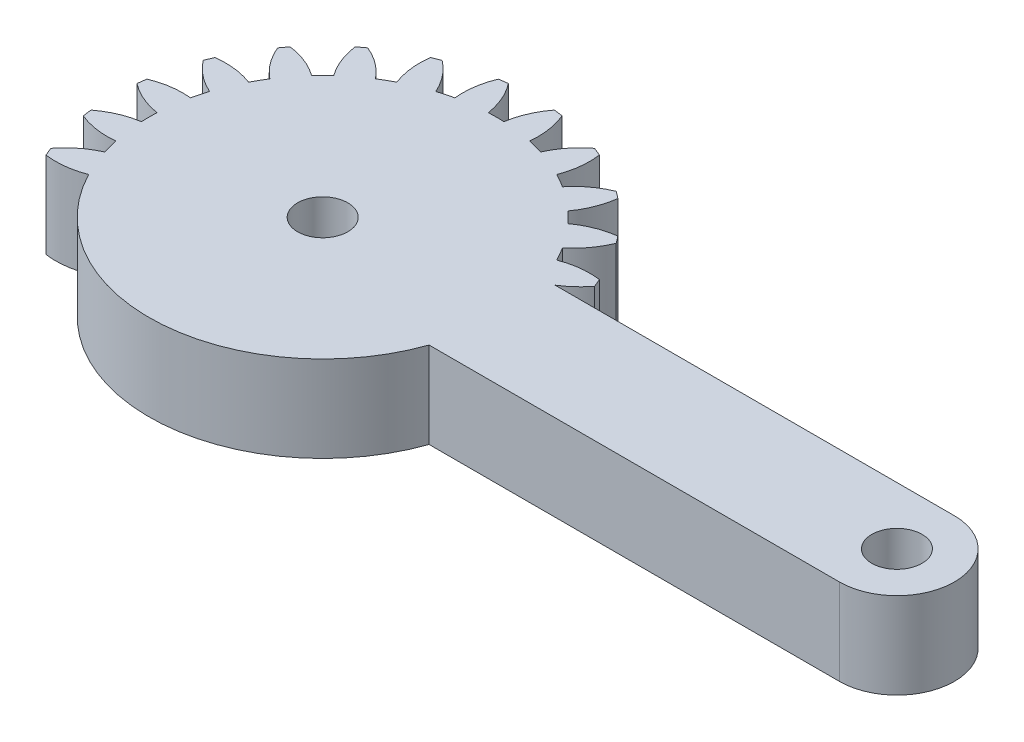
from build123d import *
from build123d.topology import SkipClean

# Parameters (mm, degrees)
SKETCH1_R           = 1.75
BOSS_EXTRUDE1_DEPTH = 4
CUT_EXTRUDE1_START  = -10
CUT_EXTRUDE1_DEPTH  = 10
MOVE_FACE1_BY       = 2


with BuildPart() as part:
    # Sketch1 → Boss-Extrude1 (new body)
    with BuildSketch(Plane(origin=(0, 0, 0), x_dir=(1, 0, 0), z_dir=(0, 1, 0))):
        with BuildLine():
            Line((29.893657446, 4), (2.081641936, 4))
            ThreePointArc((2.081641936, 4), (2.861028333, 4.588201733), (3.521749436, 5.30713988))
            ThreePointArc((3.521749436, 5.30713988), (3.405395609, 5.596745198), (3.282888305, 5.883801663))
            ThreePointArc((3.282888305, 5.883801663), (1.93527598, 5.894040025), (0.627094961, 5.57027124))
            ThreePointArc((0.627094961, 5.57027124), (0.366286148, 6.046375), (0.084372603, 6.510293938))
            ThreePointArc((0.084372603, 6.510293938), (1.018855105, 7.48132754), (1.683794586, 8.65351323))
            ThreePointArc((1.683794586, 8.65351323), (1.496450048, 8.903135899), (1.303821399, 9.148703928))
            ThreePointArc((1.303821399, 9.148703928), (-0.000522033, 8.809805691), (-1.180330337, 8.158486898))
            ThreePointArc((-1.180330337, 8.158486898), (-1.555477026, 8.550865528), (-1.947855656, 8.926012217))
            ThreePointArc((-1.947855656, 8.926012217), (-1.296536862, 10.105820521), (-0.957638625, 11.410163953))
            ThreePointArc((-0.957638625, 11.410163953), (-1.203206655, 11.602792602), (-1.452829324, 11.79013714))
            ThreePointArc((-1.452829324, 11.79013714), (-2.625015014, 11.125197659), (-3.596048616, 10.190715157))
            ThreePointArc((-3.596048616, 10.190715157), (-4.059967554, 10.472628702), (-4.536071314, 10.733437515))
            ThreePointArc((-4.536071314, 10.733437515), (-4.212302529, 12.041618533), (-4.222540891, 13.389230859))
            ThreePointArc((-4.222540891, 13.389230859), (-4.509597355, 13.511738163), (-4.799202674, 13.62809199))
            ThreePointArc((-4.799202674, 13.62809199), (-5.759348103, 12.682425791), (-6.455432668, 11.528463019))
            ThreePointArc((-6.455432668, 11.528463019), (-6.976508546, 11.680699536), (-7.503891752, 11.809396783))
            ThreePointArc((-7.503891752, 11.809396783), (-7.529737283, 13.156800143), (-7.888414517, 14.455843809))
            ThreePointArc((-7.888414517, 14.455843809), (-8.197396993, 14.499881098), (-8.507248835, 14.537314892))
            ThreePointArc((-8.507248835, 14.537314892), (-9.18992168, 13.375367565), (-9.563620196, 12.080565177))
            ThreePointArc((-9.563620196, 12.080565177), (-10.106342554, 12.09275), (-10.649064912, 12.080565177))
            ThreePointArc((-10.649064912, 12.080565177), (-11.022763428, 13.375367565), (-11.705436272, 14.537314892))
            ThreePointArc((-11.705436272, 14.537314892), (-12.015288115, 14.499881098), (-12.324270591, 14.455843809))
            ThreePointArc((-12.324270591, 14.455843809), (-12.682947825, 13.156800143), (-12.708793355, 11.809396783))
            ThreePointArc((-12.708793355, 11.809396783), (-13.236176561, 11.680699536), (-13.757252439, 11.528463019))
            ThreePointArc((-13.757252439, 11.528463019), (-14.453337005, 12.682425791), (-15.413482434, 13.62809199))
            ThreePointArc((-15.413482434, 13.62809199), (-15.703087752, 13.511738163), (-15.990144217, 13.389230859))
            ThreePointArc((-15.990144217, 13.389230859), (-16.000382579, 12.041618533), (-15.676613793, 10.733437515))
            ThreePointArc((-15.676613793, 10.733437515), (-16.152717554, 10.472628702), (-16.616636492, 10.190715157))
            ThreePointArc((-16.616636492, 10.190715157), (-17.587670094, 11.125197659), (-18.759855783, 11.79013714))
            ThreePointArc((-18.759855783, 11.79013714), (-19.009478453, 11.602792602), (-19.255046482, 11.410163953))
            ThreePointArc((-19.255046482, 11.410163953), (-18.916148245, 10.105820521), (-18.264829452, 8.926012217))
            ThreePointArc((-18.264829452, 8.926012217), (-18.657208082, 8.550865528), (-19.032354771, 8.158486898))
            ThreePointArc((-19.032354771, 8.158486898), (-20.212163074, 8.809805691), (-21.516506507, 9.148703928))
            ThreePointArc((-21.516506507, 9.148703928), (-21.709135156, 8.903135899), (-21.896479694, 8.65351323))
            ThreePointArc((-21.896479694, 8.65351323), (-21.231540213, 7.48132754), (-20.297057711, 6.510293938))
            ThreePointArc((-20.297057711, 6.510293938), (-20.578971255, 6.046375), (-20.839780068, 5.57027124))
            ThreePointArc((-20.839780068, 5.57027124), (-22.147961087, 5.894040025), (-23.495573413, 5.883801663))
            ThreePointArc((-23.495573413, 5.883801663), (-23.618080717, 5.596745198), (-23.734434544, 5.30713988))
            ThreePointArc((-23.734434544, 5.30713988), (-22.788768345, 4.346994451), (-21.634805572, 3.650909885))
            ThreePointArc((-21.634805572, 3.650909885), (-21.78704209, 3.129834008), (-21.915739337, 2.602450802))
            ThreePointArc((-21.915739337, 2.602450802), (-23.263142697, 2.576605271), (-24.562186363, 2.217928037))
            ThreePointArc((-24.562186363, 2.217928037), (-24.606223651, 1.908945561), (-24.643657446, 1.599093719))
            ThreePointArc((-24.643657446, 1.599093719), (-23.481710119, 0.916420874), (-22.186907731, 0.542722358))
            ThreePointArc((-22.186907731, 0.542722358), (-22.199092554, 0), (-22.186907731, -0.542722358))
            ThreePointArc((-22.186907731, -0.542722358), (-23.481710119, -0.916420874), (-24.643657446, -1.599093719))
            ThreePointArc((-24.643657446, -1.599093719), (-24.606223651, -1.908945561), (-24.562186363, -2.217928037))
            ThreePointArc((-24.562186363, -2.217928037), (-23.263142697, -2.576605271), (-21.915739337, -2.602450802))
            ThreePointArc((-21.915739337, -2.602450802), (-21.78704209, -3.129834008), (-21.634805572, -3.650909885))
            ThreePointArc((-21.634805572, -3.650909885), (-22.788768345, -4.346994451), (-23.734434544, -5.30713988))
            ThreePointArc((-23.734434544, -5.30713988), (-23.618080717, -5.596745198), (-23.495573413, -5.883801663))
            ThreePointArc((-23.495573413, -5.883801663), (-22.147961087, -5.894040025), (-20.839780068, -5.57027124))
            ThreePointArc((-20.839780068, -5.57027124), (-20.578971255, -6.046375), (-20.297057711, -6.510293938))
            ThreePointArc((-20.297057711, -6.510293938), (-21.231540213, -7.48132754), (-21.896479694, -8.65351323))
            ThreePointArc((-21.896479694, -8.65351323), (-21.709135156, -8.903135899), (-21.516506507, -9.148703928))
            ThreePointArc((-21.516506507, -9.148703928), (-20.212163074, -8.809805691), (-19.032354771, -8.158486898))
            ThreePointArc((-19.032354771, -8.158486898), (-18.657208082, -8.550865528), (-18.264829452, -8.926012217))
            ThreePointArc((-18.264829452, -8.926012217), (-18.916148245, -10.105820521), (-19.255046482, -11.410163953))
            ThreePointArc((-19.255046482, -11.410163953), (-19.009478453, -11.602792602), (-18.759855783, -11.79013714))
            ThreePointArc((-18.759855783, -11.79013714), (-17.587670094, -11.125197659), (-16.616636492, -10.190715157))
            ThreePointArc((-16.616636492, -10.190715157), (-16.152717554, -10.472628702), (-15.676613793, -10.733437515))
            ThreePointArc((-15.676613793, -10.733437515), (-16.000382579, -12.041618533), (-15.990144217, -13.389230859))
            ThreePointArc((-15.990144217, -13.389230859), (-15.703087752, -13.511738163), (-15.413482434, -13.62809199))
            ThreePointArc((-15.413482434, -13.62809199), (-14.453337005, -12.682425791), (-13.757252439, -11.528463019))
            ThreePointArc((-13.757252439, -11.528463019), (-13.236176561, -11.680699536), (-12.708793355, -11.809396783))
            ThreePointArc((-12.708793355, -11.809396783), (-12.682947825, -13.156800143), (-12.324270591, -14.455843809))
            ThreePointArc((-12.324270591, -14.455843809), (-12.015288115, -14.499881098), (-11.705436272, -14.537314892))
            ThreePointArc((-11.705436272, -14.537314892), (-11.022763428, -13.375367565), (-10.649064912, -12.080565177))
            ThreePointArc((-10.649064912, -12.080565177), (-10.106342554, -12.09275), (-9.563620196, -12.080565177))
            ThreePointArc((-9.563620196, -12.080565177), (-9.18992168, -13.375367565), (-8.507248835, -14.537314892))
            ThreePointArc((-8.507248835, -14.537314892), (-8.197396993, -14.499881098), (-7.888414517, -14.455843809))
            ThreePointArc((-7.888414517, -14.455843809), (-7.529737283, -13.156800143), (-7.503891752, -11.809396783))
            ThreePointArc((-7.503891752, -11.809396783), (-6.976508546, -11.680699536), (-6.455432668, -11.528463019))
            ThreePointArc((-6.455432668, -11.528463019), (-5.759348103, -12.682425791), (-4.799202674, -13.62809199))
            ThreePointArc((-4.799202674, -13.62809199), (-4.509597355, -13.511738163), (-4.222540891, -13.389230859))
            ThreePointArc((-4.222540891, -13.389230859), (-4.212302529, -12.041618533), (-4.536071314, -10.733437515))
            ThreePointArc((-4.536071314, -10.733437515), (-4.059967554, -10.472628702), (-3.596048616, -10.190715157))
            ThreePointArc((-3.596048616, -10.190715157), (-2.625015014, -11.125197659), (-1.452829324, -11.79013714))
            ThreePointArc((-1.452829324, -11.79013714), (-1.203206655, -11.602792602), (-0.957638625, -11.410163953))
            ThreePointArc((-0.957638625, -11.410163953), (-1.296536862, -10.105820521), (-1.947855656, -8.926012217))
            ThreePointArc((-1.947855656, -8.926012217), (-1.555477026, -8.550865528), (-1.180330337, -8.158486898))
            ThreePointArc((-1.180330337, -8.158486898), (-0.000522033, -8.809805691), (1.303821399, -9.148703928))
            ThreePointArc((1.303821399, -9.148703928), (1.496450048, -8.903135899), (1.683794586, -8.65351323))
            ThreePointArc((1.683794586, -8.65351323), (1.018855105, -7.48132754), (0.084372603, -6.510293938))
            ThreePointArc((0.084372603, -6.510293938), (0.366286148, -6.046375), (0.627094961, -5.57027124))
            ThreePointArc((0.627094961, -5.57027124), (1.93527598, -5.894040025), (3.282888305, -5.883801663))
            ThreePointArc((3.282888305, -5.883801663), (3.405395609, -5.596745198), (3.521749436, -5.30713988))
            ThreePointArc((3.521749436, -5.30713988), (2.861028333, -4.588201733), (2.081641936, -4))
            Line((2.081641936, -4), (29.893658255, -4))
            ThreePointArc((29.893658255, -4), (33.893657446, 4.04e-07), (29.893657446, 4))
        make_face()
        with Locations(Location((-10.106342554, 0, 0), (0, 0, 270))):
            Circle(SKETCH1_R, mode=Mode.SUBTRACT)
        with Locations(Location((29.893657446, 0, 0), (0, 0, 270))):
            Circle(SKETCH1_R, mode=Mode.SUBTRACT)
    extrude(amount=BOSS_EXTRUDE1_DEPTH)

    # Sketch2 → Cut-Extrude1 (cut)
    with SkipClean():  # the faces are left unmerged after this step: merging them gives an invalid solid
        with BuildSketch(Plane(origin=(0, 4, 0), x_dir=(1, 0, 0), z_dir=(0, 1, 0)).offset(CUT_EXTRUDE1_START)):
            with BuildLine():
                ThreePointArc((-21.516506507, -9.148703928), (-20.212163074, -8.809805691), (-19.032354771, -8.158486898))
                ThreePointArc((-19.032354771, -8.158486898), (-19.70016616, -7.361599771), (-20.297057711, -6.510293938))
                ThreePointArc((-20.297057711, -6.510293938), (-21.231540213, -7.48132754), (-21.896479694, -8.65351323))
                ThreePointArc((-21.896479694, -8.65351323), (-21.709135156, -8.903135899), (-21.516506507, -9.148703928))
            make_face()
            with BuildLine():
                ThreePointArc((-18.759855783, -11.79013714), (-17.587670094, -11.125197659), (-16.616636492, -10.190715157))
                ThreePointArc((-16.616636492, -10.190715157), (-17.467942324, -9.593823606), (-18.264829452, -8.926012217))
                ThreePointArc((-18.264829452, -8.926012217), (-18.916148245, -10.105820521), (-19.255046482, -11.410163953))
                ThreePointArc((-19.255046482, -11.410163953), (-19.009478453, -11.602792602), (-18.759855783, -11.79013714))
            make_face()
            with BuildLine():
                ThreePointArc((-15.413482434, -13.62809199), (-14.453337005, -12.682425791), (-13.757252439, -11.528463019))
                ThreePointArc((-13.757252439, -11.528463019), (-14.734037631, -11.172244217), (-15.676613793, -10.733437515))
                ThreePointArc((-15.676613793, -10.733437515), (-16.000382579, -12.041618533), (-15.990144217, -13.389230859))
                ThreePointArc((-15.990144217, -13.389230859), (-15.703087752, -13.511738163), (-15.413482434, -13.62809199))
            make_face()
            with BuildLine():
                ThreePointArc((-11.705436272, -14.537314892), (-11.022763428, -13.375367565), (-10.649064912, -12.080565177))
                ThreePointArc((-10.649064912, -12.080565177), (-11.684763165, -11.989294847), (-12.708793355, -11.809396783))
                ThreePointArc((-12.708793355, -11.809396783), (-12.682947825, -13.156800143), (-12.324270591, -14.455843809))
                ThreePointArc((-12.324270591, -14.455843809), (-12.015288115, -14.499881098), (-11.705436272, -14.537314892))
            make_face()
            with BuildLine():
                ThreePointArc((-7.888414517, -14.455843809), (-7.529737283, -13.156800143), (-7.503891752, -11.809396783))
                ThreePointArc((-7.503891752, -11.809396783), (-8.527921943, -11.989294847), (-9.563620196, -12.080565177))
                ThreePointArc((-9.563620196, -12.080565177), (-9.18992168, -13.375367565), (-8.507248835, -14.537314892))
                ThreePointArc((-8.507248835, -14.537314892), (-8.197396993, -14.499881098), (-7.888414517, -14.455843809))
            make_face()
            with BuildLine():
                ThreePointArc((-4.222540891, -13.389230859), (-4.212302529, -12.041618533), (-4.536071314, -10.733437515))
                ThreePointArc((-4.536071314, -10.733437515), (-5.478647477, -11.172244217), (-6.455432668, -11.528463019))
                ThreePointArc((-6.455432668, -11.528463019), (-5.759348103, -12.682425791), (-4.799202674, -13.62809199))
                ThreePointArc((-4.799202674, -13.62809199), (-4.509597355, -13.511738163), (-4.222540891, -13.389230859))
            make_face()
            with BuildLine():
                ThreePointArc((-0.957638625, -11.410163953), (-1.296536862, -10.105820521), (-1.947855656, -8.926012217))
                ThreePointArc((-1.947855656, -8.926012217), (-2.744742783, -9.593823606), (-3.596048616, -10.190715157))
                ThreePointArc((-3.596048616, -10.190715157), (-2.625015014, -11.125197659), (-1.452829324, -11.79013714))
                ThreePointArc((-1.452829324, -11.79013714), (-1.203206655, -11.602792602), (-0.957638625, -11.410163953))
            make_face()
            with BuildLine():
                ThreePointArc((1.683794586, -8.65351323), (1.018855105, -7.48132754), (0.084372603, -6.510293938))
                ThreePointArc((0.084372603, -6.510293938), (-0.512518948, -7.361599771), (-1.180330337, -8.158486898))
                ThreePointArc((-1.180330337, -8.158486898), (-0.000522033, -8.809805691), (1.303821399, -9.148703928))
                ThreePointArc((1.303821399, -9.148703928), (1.496450048, -8.903135899), (1.683794586, -8.65351323))
            make_face()
            with BuildLine():
                ThreePointArc((3.521749436, -5.30713988), (2.861028333, -4.588201733), (2.081641936, -4))
                Line((2.081641936, -4), (1.305695063, -4))
                ThreePointArc((1.305695063, -4), (0.994195953, -4.797149927), (0.627094961, -5.57027124))
                ThreePointArc((0.627094961, -5.57027124), (1.93527598, -5.894040025), (3.282888305, -5.883801663))
                ThreePointArc((3.282888305, -5.883801663), (3.405395609, -5.596745198), (3.521749436, -5.30713988))
            make_face()
        extrude(amount=CUT_EXTRUDE1_DEPTH, mode=Mode.SUBTRACT)

    # Move Face1: a face moved outward by 2.0
    extrude(part.faces().sort_by_distance((-1.561241714, 0, -0.498914488))[0], amount=MOVE_FACE1_BY, dir=(0, -1, 0))


solid = part.part
